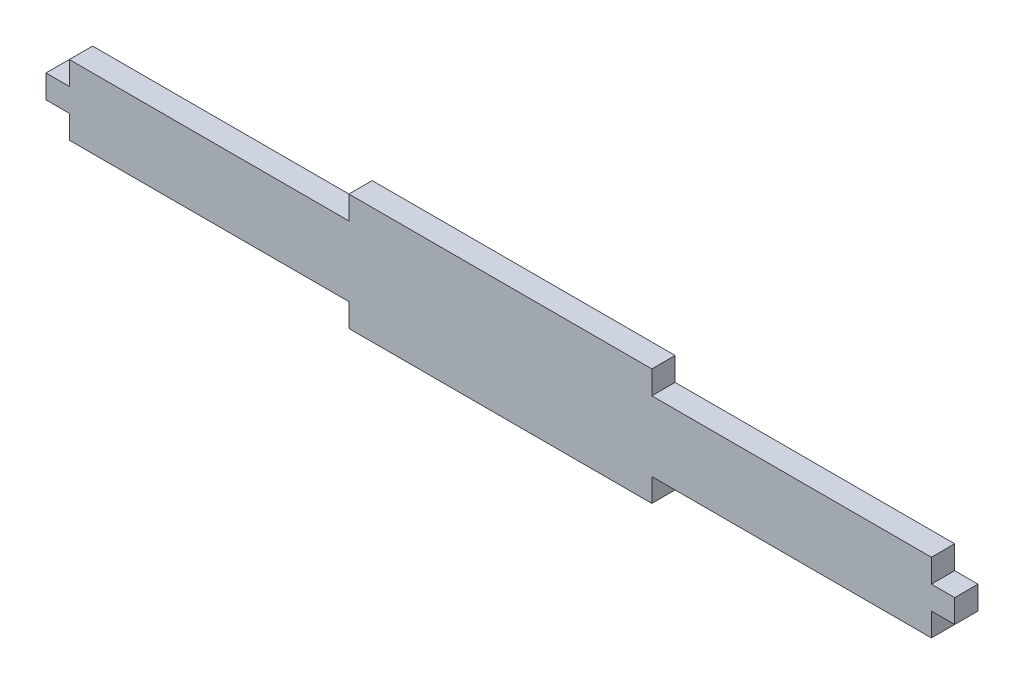
from build123d import *

# Parameters (mm, degrees)
BOSS_EXTRUDE1_DEPTH = 3


with BuildPart() as part:
    # Sketch1 → Boss-Extrude1 (new body)
    with BuildSketch(Plane.XY):
        Polygon((-19.5, -7.5), (19.5, -7.5), (19.5, -4.5), (55.5, -4.5), (55.5, -1.5), (58.5, -1.5), (58.5, 1.5), (55.5, 1.5), (55.5, 4.5), (19.5, 4.5), (19.5, 7.5), (-19.5, 7.5), (-19.5, 4.5), (-55.5, 4.5), (-55.5, 1.5), (-58.5, 1.5), (-58.5, -1.5), (-55.5, -1.5), (-55.5, -4.5), (-19.5, -4.5), align=None)
    extrude(amount=BOSS_EXTRUDE1_DEPTH)


solid = part.part
